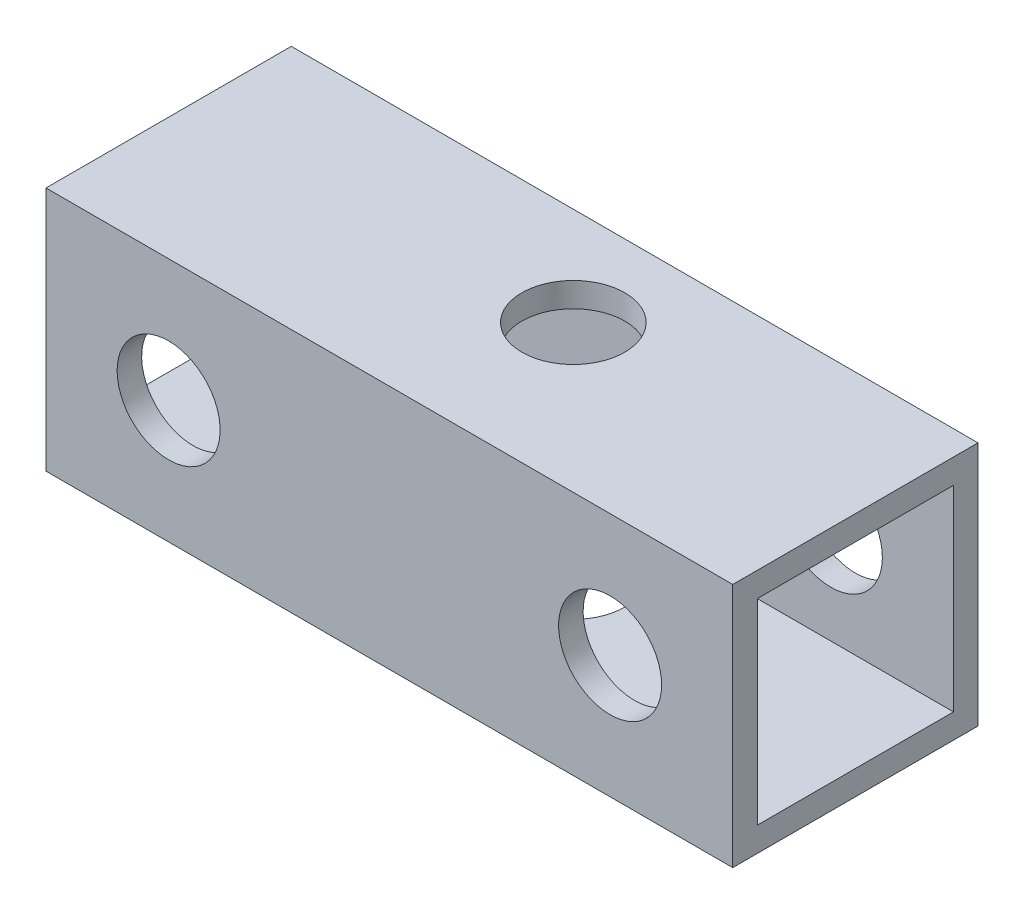
from build123d import *

# Parameters (mm, degrees)
SKETCH_1_W          = 10
SKETCH_1_H          = 10
SKETCH_1_W_2        = 8
SKETCH_1_H_2        = 8
EXTRUDE_1_DEPTH     = 28
SKETCH_4_R          = 2.1
CUT_EXTRUDE_3_DEPTH = 31.149626863
SKETCH_5_R          = 2.1
CUT_EXTRUDE_4_DEPTH = 31.149626863
SKETCH_6_R          = 4
CUT_EXTRUDE_5_DEPTH = 1


with BuildPart() as part:
    # ｽｹｯﾁ1 → 押し出し-薄板1 (new body)
    with BuildSketch(Plane(origin=(0, 0, 0), x_dir=(0, 0, -1), z_dir=(1, 0, 0))):
        Rectangle(SKETCH_1_W, SKETCH_1_H)
        Rectangle(SKETCH_1_W_2, SKETCH_1_H_2, mode=Mode.SUBTRACT)
    extrude(amount=EXTRUDE_1_DEPTH)

    # ｽｹｯﾁ4 → ｶｯﾄ - 押し出し3 (cut, through all)
    with BuildSketch(Plane.XY.offset(5)):
        with Locations((23, 0)):
            Circle(SKETCH_4_R)
        with Locations(Location((5, 0, 0), (0, 0, 90))):
            Circle(SKETCH_4_R)
    extrude(amount=-CUT_EXTRUDE_3_DEPTH, mode=Mode.SUBTRACT)

    # ｽｹｯﾁ5 → ｶｯﾄ - 押し出し4 (cut, through all)
    with BuildSketch(Plane(origin=(0, 5, 0), x_dir=(1, 0, 0), z_dir=(0, 1, 0))):
        with Locations(Location((15.5, 1, 0), (0, 0, 270))):
            Circle(SKETCH_5_R)
    extrude(amount=-CUT_EXTRUDE_4_DEPTH, mode=Mode.SUBTRACT)

    # ｽｹｯﾁ6 → ｶｯﾄ - 押し出し5 (cut)
    with BuildSketch(Plane(origin=(0, 0, -5), x_dir=(-1, 0, 0), z_dir=(0, 0, -1))):
        with Locations(Location((-5, 0, 0), (0, 0, 90))):
            Circle(SKETCH_6_R)
    extrude(amount=-CUT_EXTRUDE_5_DEPTH, mode=Mode.SUBTRACT)


solid = part.part
